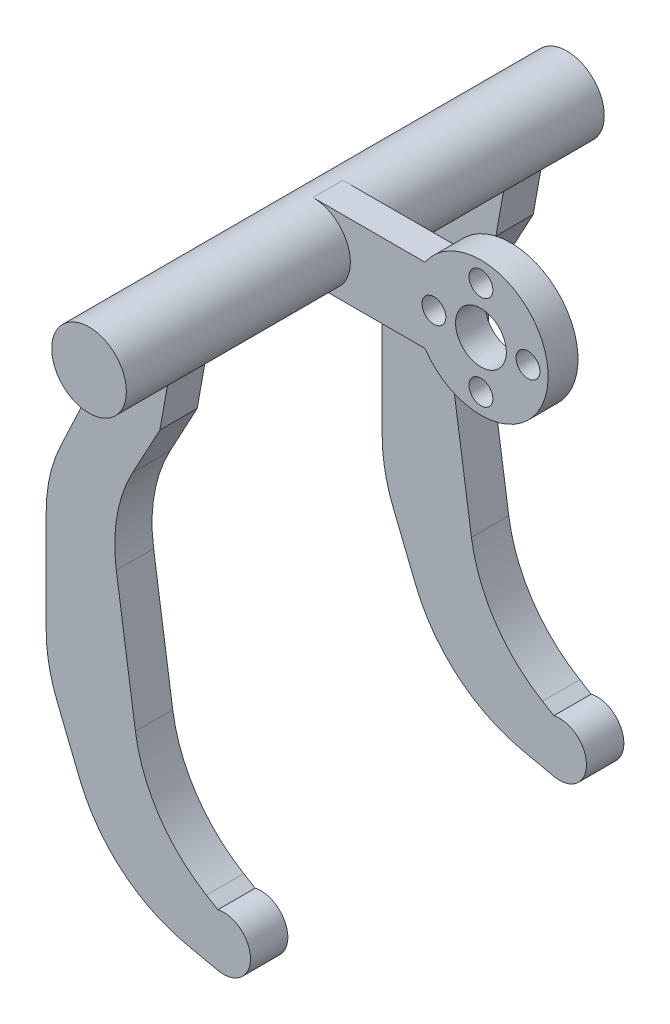
from build123d import *

# Parameters (mm, degrees)
SKETCH2_R                = 11.43
BOSS_EXTRUDE1_DEPTH      = 5.08
SKETCH4_R                = 4.318
SKETCH4_R_2              = 2.032
CUT_EXTRUDE1_DEPTH       = 5.08
BOSS_EXTRUDE2_DEPTH      = 5.08
CIRPATTERN1_COUNT        = 4
BOSS_EXTRUDE3_DEPTH      = 38.1
BOSS_EXTRUDE3_DEPTH_BACK = 43.18
SKETCH9_R                = 6.35
BOSS_EXTRUDE4_DEPTH      = 6.35
FILLET1_R                = 25.4
FILLET1_OF_MIRROR1_R     = 25.4


with BuildPart() as part:
    # Sketch2 → Boss-Extrude1 (new body)
    with BuildSketch(Plane.XY):
        Circle(SKETCH2_R)
    extrude(amount=BOSS_EXTRUDE1_DEPTH)

    # Sketch4 → Cut-Extrude1 (cut)
    with BuildSketch(Plane(origin=(0, 0, 0), x_dir=(-1, 0, 0), z_dir=(0, 0, -1))):
        Circle(SKETCH4_R)
        with Locations((0, -8.001)):
            Circle(SKETCH4_R_2)
    cut_extrude1 = extrude(amount=-CUT_EXTRUDE1_DEPTH, mode=Mode.SUBTRACT)

    # Sketch7 → Boss-Extrude2 (add)
    with BuildSketch(Plane(origin=(0, 0, 0), x_dir=(-1, 0, 0), z_dir=(0, 0, -1))):
        with BuildLine():
            Line((9.503809762, 6.35), (28.553809762, 6.35))
            ThreePointArc((28.553809762, 6.35), (34.903809762, 0), (28.553809762, -6.35))
            Line((28.553809762, -6.35), (9.503809762, -6.35))
            Line((9.503809762, -6.35), (9.503809762, 6.35))
        make_face()
    extrude(amount=-BOSS_EXTRUDE2_DEPTH)

    # CirPattern1: Cut-Extrude1 ×4 about axis
    cirpattern1_axis = Axis((0, 0, 0), (0, 0, 1))
    for i in range(1, CIRPATTERN1_COUNT):
        add(cut_extrude1.rotate(cirpattern1_axis, i * 360 / CIRPATTERN1_COUNT), mode=Mode.SUBTRACT)

    # Sketch9 → Boss-Extrude3 (add, two sides: drawn at the far end of the back side and taken through both)
    with BuildSketch(Plane.XY.offset(5.08).offset(-BOSS_EXTRUDE3_DEPTH_BACK)):
        with Locations((-28.553809762, 0)):
            Circle(SKETCH9_R)
    extrude(amount=BOSS_EXTRUDE3_DEPTH + BOSS_EXTRUDE3_DEPTH_BACK)

    # Sketch12 → Boss-Extrude4 (add)
    with BuildSketch(Plane.XY.offset(-31.75)):
        with BuildLine():
            Line((-25.378809762, 0), (-33.047894508, 0))
            Line((-33.047894508, 0), (-47.267412368, -30.245447294))
            Line((-47.267412368, -30.245447294), (-47.267412368, -58.33420365))
            Line((-47.267412368, -58.33420365), (-36.57534741, -84.867934272))
            Line((-36.57534741, -84.867934272), (-18.073665796, -88.9))
            ThreePointArc((-18.073665796, -88.9), (-12.52460446, -84.430000607), (-18.073665796, -79.960001215))
            Line((-18.073665796, -79.960001215), (-30.345802798, -72.608060715))
            Line((-30.345802798, -72.608060715), (-36.57534741, -30.245447294))
            Line((-36.57534741, -30.245447294), (-27.94, -14.249719927))
            Line((-27.94, -14.249719927), (-25.378809762, 0))
        make_face()
    boss_extrude4 = extrude(amount=BOSS_EXTRUDE4_DEPTH)

    # Fillet1
    fillet1_edges = [part.edges().sort_by_distance(p)[0] for p in [
        (-36.57534741, -84.867934272, -28.575),
        (-30.345802798, -72.608060715, -28.575),
        (-36.57534741, -30.245447294, -28.575),
        (-47.267412368, -30.245447294, -28.575),
        (-47.267412368, -58.33420365, -28.575),
    ]]
    fillet(fillet1_edges, radius=FILLET1_R)

    # Mirror1: Boss-Extrude4 across plane
    add(boss_extrude4.mirror(Plane.XY))

    # Fillet1 of Mirror1
    fillet1_of_mirror1_edges = [part.edges().sort_by_distance(p)[0] for p in [
        (-36.57534741, -84.867934272, 28.575),
        (-30.345802798, -72.608060715, 28.575),
        (-36.57534741, -30.245447294, 28.575),
        (-47.267412368, -30.245447294, 28.575),
        (-47.267412368, -58.33420365, 28.575),
    ]]
    fillet(fillet1_of_mirror1_edges, radius=FILLET1_OF_MIRROR1_R)


solid = part.part
